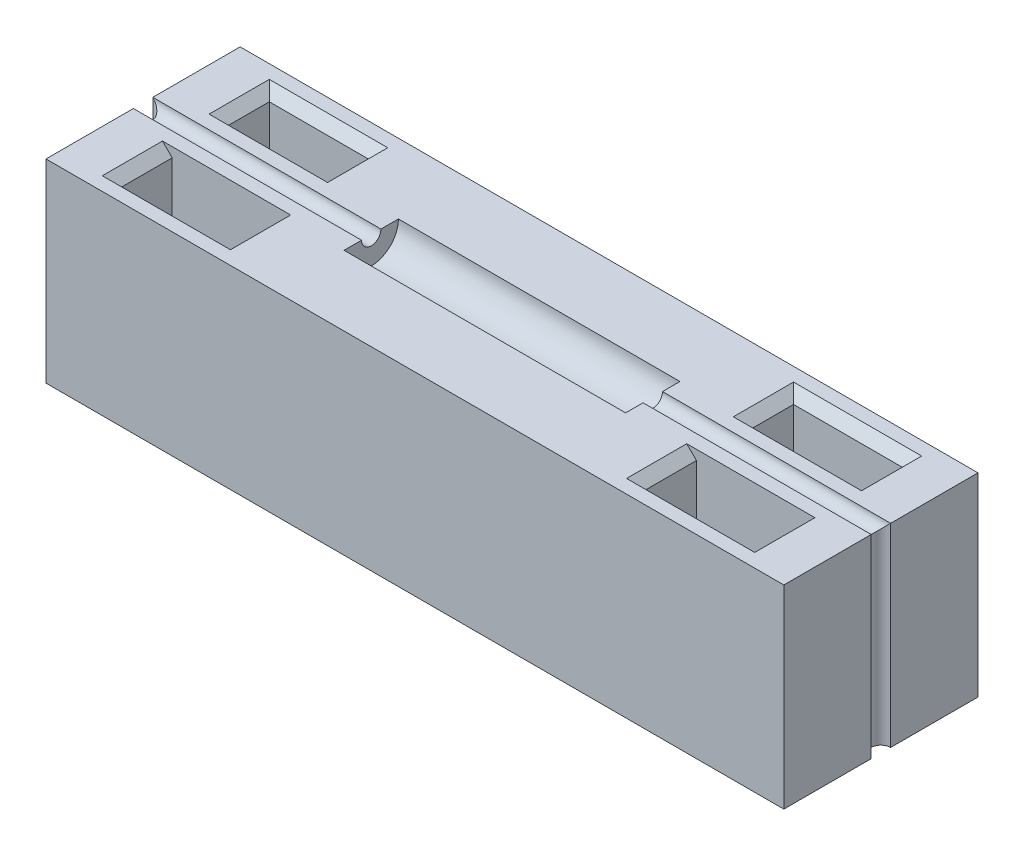
from build123d import *

# Parameters (mm, degrees)
SKETCH1_W           = 38
SKETCH1_H           = 10
BOSS_EXTRUDE1_DEPTH = 10
SKETCH3_R           = 0.5
CUT_EXTRUDE1_DEPTH  = 41.546269865
SKETCH4_W           = 5.6
SKETCH4_H           = 2.6
CUT_EXTRUDE2_DEPTH  = 4.2
CHAMFER1_SIZE       = 0.5


with BuildPart() as part:
    # Sketch1 → Boss-Extrude1 (new body)
    with BuildSketch(Plane(origin=(0, 0, 0), x_dir=(1, 0, 0), z_dir=(0, 1, 0))):
        with Locations((19, 5)):
            Rectangle(SKETCH1_W, SKETCH1_H)
    extrude(amount=BOSS_EXTRUDE1_DEPTH)

    # Sketch2 → Cut-Revolve1 (revolve, cut)
    with BuildSketch(Plane(origin=(0, 10, 0), x_dir=(1, 0, 0), z_dir=(0, 1, 0))):
        Polygon((0, 5), (38, 5), (38, 4.5), (26.25, 4.5), (26.25, 3.6), (11.75, 3.6), (11.75, 4.5), (0, 4.5), align=None)
    revolve(axis=Axis((0, 10, -5), (1, 0, 0)), mode=Mode.SUBTRACT)

    # Sketch3 → Cut-Extrude1 (cut, through all)
    with BuildSketch(Plane(origin=(0, 10, 0), x_dir=(1, 0, 0), z_dir=(0, 1, 0))):
        with Locations((0, 5)):
            Circle(SKETCH3_R)
        with Locations((38, 5)):
            Circle(SKETCH3_R)
    extrude(amount=-CUT_EXTRUDE1_DEPTH, mode=Mode.SUBTRACT)

    # Sketch4 → Cut-Extrude2 (cut)
    with BuildSketch(Plane(origin=(0, 10, 0), x_dir=(1, 0, 0), z_dir=(0, 1, 0))):
        with Locations((5.5, 7.5)):
            Rectangle(SKETCH4_W, SKETCH4_H)
        with Locations((5.5, 2.5)):
            Rectangle(SKETCH4_W, SKETCH4_H)
        with Locations((32.5, 7.5)):
            Rectangle(SKETCH4_W, SKETCH4_H)
        with Locations((32.5, 2.5)):
            Rectangle(SKETCH4_W, SKETCH4_H)
    extrude(amount=-CUT_EXTRUDE2_DEPTH, mode=Mode.SUBTRACT)

    # Chamfer1
    chamfer1_edges = [part.edges().sort_by_distance(p)[0] for p in [
        (35.3, 10, -2.5),
        (32.5, 10, -1.2),
        (29.7, 10, -2.5),
        (35.3, 10, -7.5),
        (29.7, 10, -7.5),
        (32.5, 10, -8.8),
        (8.3, 10, -2.5),
        (5.5, 10, -1.2),
        (2.7, 10, -2.5),
        (2.7, 10, -7.5),
        (5.5, 10, -8.8),
    ]]
    chamfer(chamfer1_edges, length=CHAMFER1_SIZE)


solid = part.part
